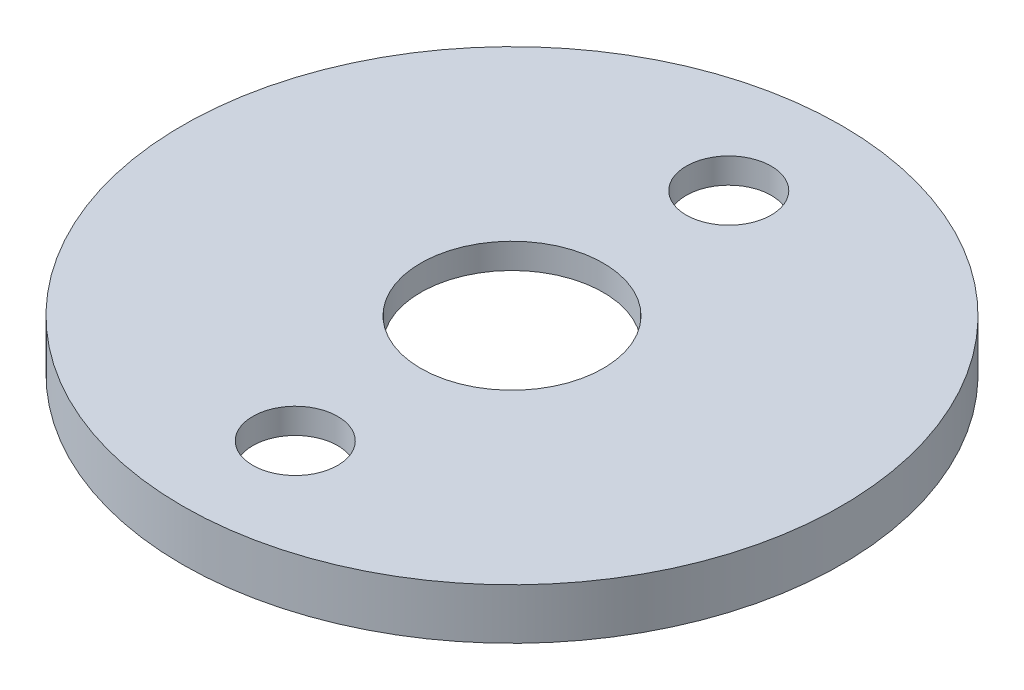
from build123d import *

# Parameters (mm, degrees)
SKETCH1_R           = 12.5
BOSS_EXTRUDE1_DEPTH = 1
SKETCH2_R           = 1.675
SKETCH2_R_2         = 3.6
CUT_EXTRUDE1_DEPTH  = 1
BOSS_EXTRUDE3_START = -2
SKETCH3_R           = 13
SKETCH3_R_2         = 12.5
BOSS_EXTRUDE3_DEPTH = 2
SKETCH5_R           = 12.6
CUT_EXTRUDE2_DEPTH  = 1


with BuildPart() as part:
    # Sketch1 → Boss-Extrude1 (new body)
    with BuildSketch(Plane(origin=(0, 0, 0), x_dir=(1, 0, 0), z_dir=(0, 1, 0))):
        with Locations(Location((0, 0, 0), (0, 0, 270))):
            Circle(SKETCH1_R)
    extrude(amount=BOSS_EXTRUDE1_DEPTH)

    # Sketch2 → Cut-Extrude1 (cut)
    with BuildSketch(Plane(origin=(0, 1, 0), x_dir=(1, 0, 0), z_dir=(0, 1, 0))):
        with Locations(Location((0, 8.55, 0), (0, 0, 270))):
            Circle(SKETCH2_R)
        with Locations(Location((0, -8.55, 0), (0, 0, 270))):
            Circle(SKETCH2_R)
        with Locations(Location((0, 0, 0), (0, 0, 270))):
            Circle(SKETCH2_R_2)
    extrude(amount=-CUT_EXTRUDE1_DEPTH, mode=Mode.SUBTRACT)

    # Sketch3 → Boss-Extrude3 (add)
    with BuildSketch(Plane(origin=(0, 1, 0), x_dir=(1, 0, 0), z_dir=(0, 1, 0)).offset(BOSS_EXTRUDE3_START)):
        with Locations(Location((0, 0, 0), (0, 0, 270))):
            Circle(SKETCH3_R)
        with Locations(Location((0, 0, 0), (0, 0, 270))):
            Circle(SKETCH3_R_2, mode=Mode.SUBTRACT)
    extrude(amount=BOSS_EXTRUDE3_DEPTH)

    # Sketch5 → Cut-Extrude2 (cut)
    with BuildSketch(Plane.XZ.offset(1)):
        with Locations(Location((0, 0, 0), (0, 0, 270))):
            Circle(SKETCH5_R)
    extrude(amount=-CUT_EXTRUDE2_DEPTH, mode=Mode.SUBTRACT)


solid = part.part
